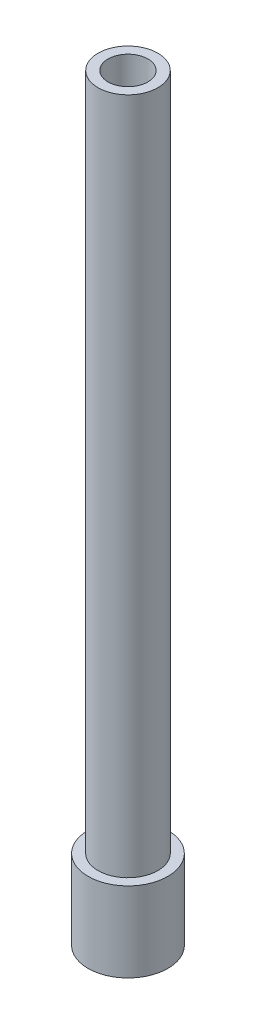
from build123d import *

# Parameters (mm, degrees)
SKETCH1_R           = 3.175
BOSS_EXTRUDE1_DEPTH = 6.35
SKETCH4_R           = 2.38125
BOSS_EXTRUDE3_DEPTH = 53.975
SKETCH5_R           = 1.5875
CUT_EXTRUDE1_DEPTH  = 61.491874454


with BuildPart() as part:
    # Sketch1 → Boss-Extrude1 (new body)
    with BuildSketch(Plane(origin=(0, 0, 0), x_dir=(1, 0, 0), z_dir=(0, 1, 0))):
        with Locations(Location((0, 0, 0), (0, 0, 270))):
            Circle(SKETCH1_R)
    extrude(amount=BOSS_EXTRUDE1_DEPTH)

    # Sketch4 → Boss-Extrude3 (add)
    with BuildSketch(Plane(origin=(0, 6.35, 0), x_dir=(1, 0, 0), z_dir=(0, 1, 0))):
        with Locations(Location((0, 0, 0), (0, 0, 270))):
            Circle(SKETCH4_R)
    extrude(amount=BOSS_EXTRUDE3_DEPTH)

    # Sketch5 → Cut-Extrude1 (cut, through all)
    with BuildSketch(Plane(origin=(0, 60.325, 0), x_dir=(1, 0, 0), z_dir=(0, 1, 0))):
        with Locations(Location((0, 0, 0), (0, 0, 270))):
            Circle(SKETCH5_R)
    extrude(amount=-CUT_EXTRUDE1_DEPTH, mode=Mode.SUBTRACT)


solid = part.part
